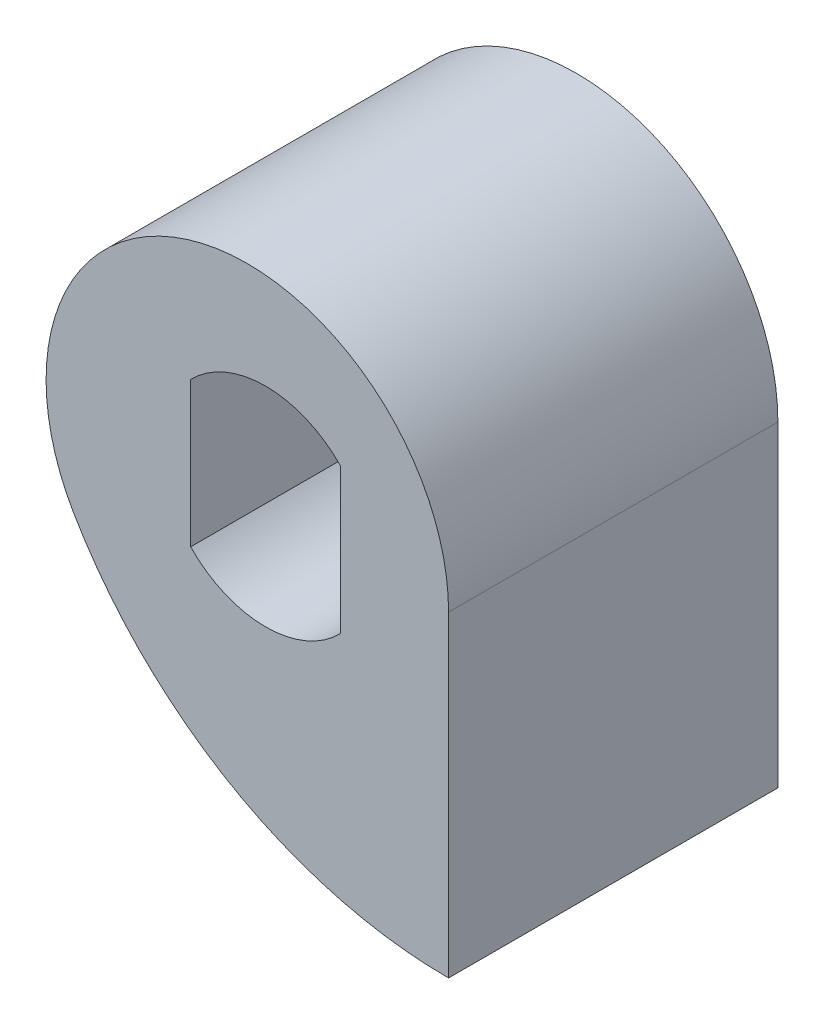
from build123d import *

# Parameters (mm, degrees)
EXTRUDE_935_DEPTH      = 4.5
EXTRUDE_935_DEPTH_BACK = 4.5


with BuildPart() as part:
    # Эскиз1 → Extrude 935 (new, two sides: drawn at the far end of the back side and taken through both)
    with BuildSketch(Plane.XY.offset(-EXTRUDE_935_DEPTH_BACK)):
        with BuildLine():
            Line((5, 0), (5, -8.660254038))
            ThreePointArc((5, -8.660254038), (-0.911767719, -7.082761379), (-5.251705953, -2.769709468))
            ThreePointArc((-5.251705953, -2.769709468), (-1.934506406, 5.309631943), (5, 0))
        make_face()
        with BuildLine():
            Line((-2.05, 1.979898987), (-2.05, -1.979898987))
            ThreePointArc((-2.05, -1.979898987), (0, -2.85), (2.05, -1.979898987))
            Line((2.05, -1.979898987), (2.05, 1.979898987))
            ThreePointArc((2.05, 1.979898987), (0, 2.85), (-2.05, 1.979898987))
        make_face(mode=Mode.SUBTRACT)
    extrude(amount=EXTRUDE_935_DEPTH + EXTRUDE_935_DEPTH_BACK)


solid = part.part
